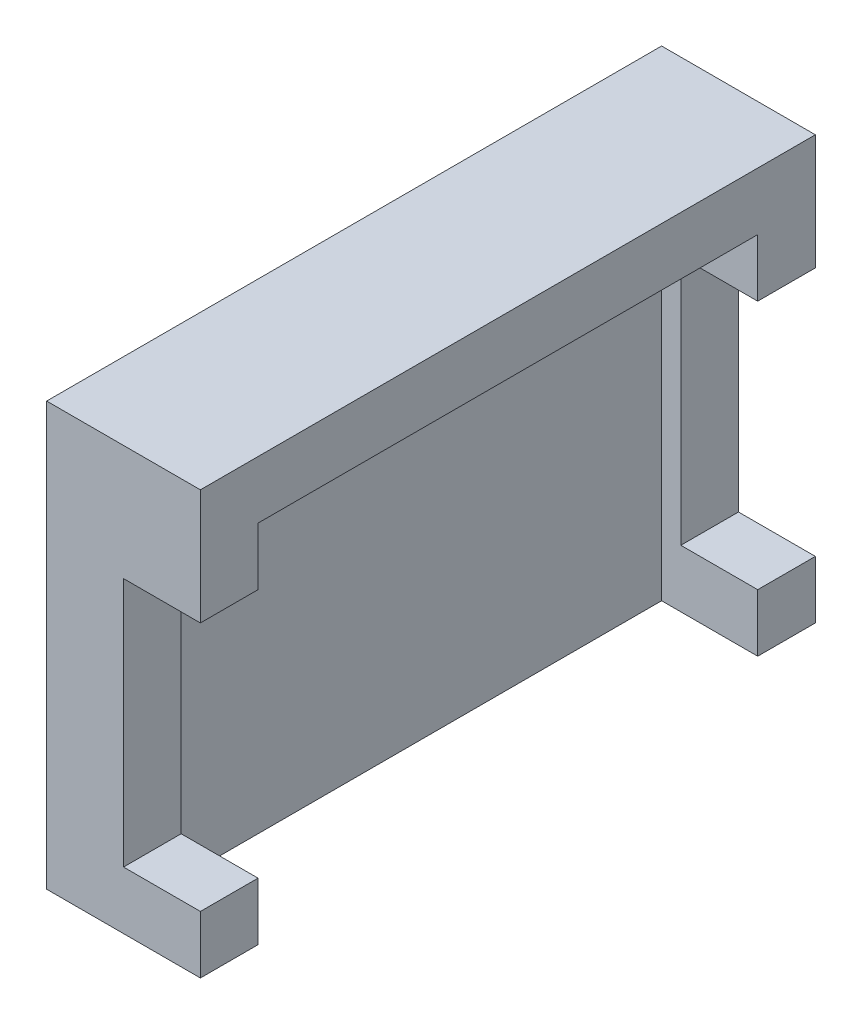
from build123d import *

# Parameters (mm, degrees)
SKETCH1_W           = 32
SKETCH1_H           = 22
BOSS_EXTRUDE1_DEPTH = 3
BOSS_EXTRUDE6_DEPTH = 5
SKETCH8_W           = 4
SKETCH8_H           = 13
CUT_EXTRUDE3_DEPTH  = 32


with BuildPart() as part:
    # Sketch1 → Boss-Extrude1 (new body)
    with BuildSketch(Plane(origin=(0, 0, 0), x_dir=(0, 0, -1), z_dir=(1, 0, 0))):
        Rectangle(SKETCH1_W, SKETCH1_H)
    extrude(amount=BOSS_EXTRUDE1_DEPTH)

    # Sketch7 → Boss-Extrude6 (add)
    with BuildSketch(Plane(origin=(3, 0, 0), x_dir=(0, 0, -1), z_dir=(1, 0, 0))):
        Polygon((16, -11), (16, 11), (-16, 11), (-16, -11), (-13, -11), (-13, 8), (13, 8), (13, -11), align=None)
    extrude(amount=BOSS_EXTRUDE6_DEPTH)

    # Sketch8 → Cut-Extrude3 (cut)
    with BuildSketch(Plane.XY.offset(16)):
        with Locations((6, -1.5)):
            Rectangle(SKETCH8_W, SKETCH8_H)
    extrude(amount=-CUT_EXTRUDE3_DEPTH, mode=Mode.SUBTRACT)


solid = part.part
